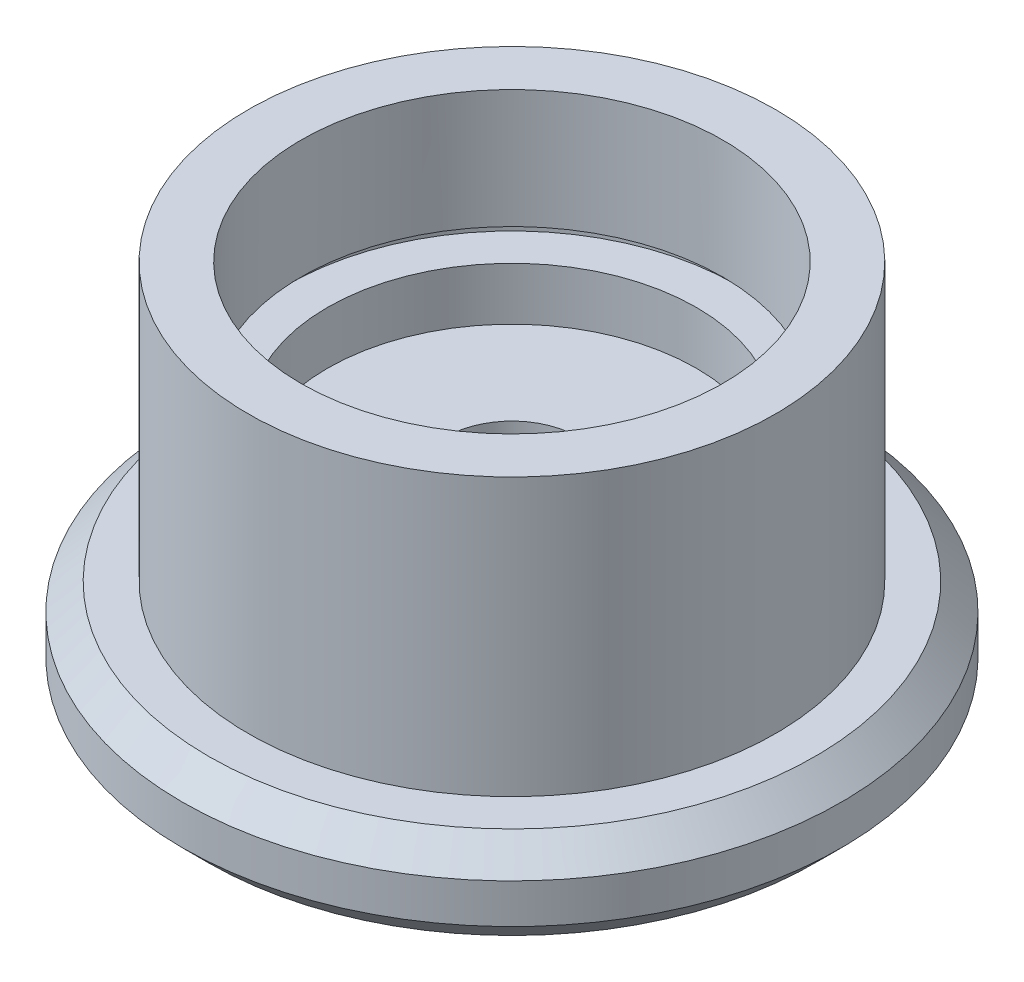
from build123d import *

# Parameters (mm, degrees)
ESQUISSE1_R             = 12.5
BOSS_EXTRU_1_DEPTH      = 3.5
ESQUISSE2_R             = 10
BOSS_EXTRU_2_DEPTH      = 10.5
ESQUISSE3_R             = 2.5
ENL_V_MAT_EXTRU_1_DEPTH = 7
ESQUISSE4_R             = 7
ENL_V_MAT_EXTRU_2_DEPTH = 2
ESQUISSE5_R             = 8.5
ENL_V_MAT_EXTRU_3_DEPTH = 0.5
ESQUISSE6_R             = 8
ENL_V_MAT_EXTRU_4_DEPTH = 5
CHANFREIN1_SIZE         = 1
CHANFREIN2_SIZE         = 1


with BuildPart() as part:
    # Esquisse1 → Boss.-Extru.1 (new body)
    with BuildSketch(Plane(origin=(0, 0, 0), x_dir=(1, 0, 0), z_dir=(0, 1, 0))):
        with Locations(Location((0, 0, 0), (0, 0, 270))):
            Circle(ESQUISSE1_R)
    extrude(amount=BOSS_EXTRU_1_DEPTH)

    # Esquisse2 → Boss.-Extru.2 (add)
    with BuildSketch(Plane(origin=(0, 3.5, 0), x_dir=(1, 0, 0), z_dir=(0, 1, 0))):
        with Locations(Location((0, 0, 0), (0, 0, 90))):
            Circle(ESQUISSE2_R)
    extrude(amount=BOSS_EXTRU_2_DEPTH)

    # Esquisse3 → Enlèv. mat.-Extru.1 (cut)
    with BuildSketch(Plane.XZ):
        with Locations(Location((0, 0, 0), (0, 0, 270))):
            Circle(ESQUISSE3_R)
    extrude(amount=-ENL_V_MAT_EXTRU_1_DEPTH, mode=Mode.SUBTRACT)

    # Esquisse4 → Enlèv. mat.-Extru.2 (cut)
    with BuildSketch(Plane.XZ.offset(-7)):
        with Locations(Location((0, 0, 0), (0, 0, 270))):
            Circle(ESQUISSE4_R)
    extrude(amount=-ENL_V_MAT_EXTRU_2_DEPTH, mode=Mode.SUBTRACT)

    # Esquisse5 → Enlèv. mat.-Extru.3 (cut)
    with BuildSketch(Plane.XZ.offset(-9)):
        with Locations(Location((0, 0, 0), (0, 0, 270))):
            Circle(ESQUISSE5_R)
    extrude(amount=-ENL_V_MAT_EXTRU_3_DEPTH, mode=Mode.SUBTRACT)

    # Esquisse6 → Enlèv. mat.-Extru.4 (cut)
    with BuildSketch(Plane(origin=(0, 14, 0), x_dir=(1, 0, 0), z_dir=(0, 1, 0))):
        with Locations(Location((0, 0, 0), (0, 0, 270))):
            Circle(ESQUISSE6_R)
    extrude(amount=-ENL_V_MAT_EXTRU_4_DEPTH, mode=Mode.SUBTRACT)

    # Chanfrein1
    chanfrein1_edges = [part.edges().sort_by_distance(p)[0] for p in [
        (0, 3.5, -12.5),
    ]]
    chamfer(chanfrein1_edges, length=CHANFREIN1_SIZE)

    # Chanfrein2
    chanfrein2_edges = [part.edges().sort_by_distance(p)[0] for p in [
        (0, 0, -12.5),
    ]]
    chamfer(chanfrein2_edges, length=CHANFREIN2_SIZE)


solid = part.part
